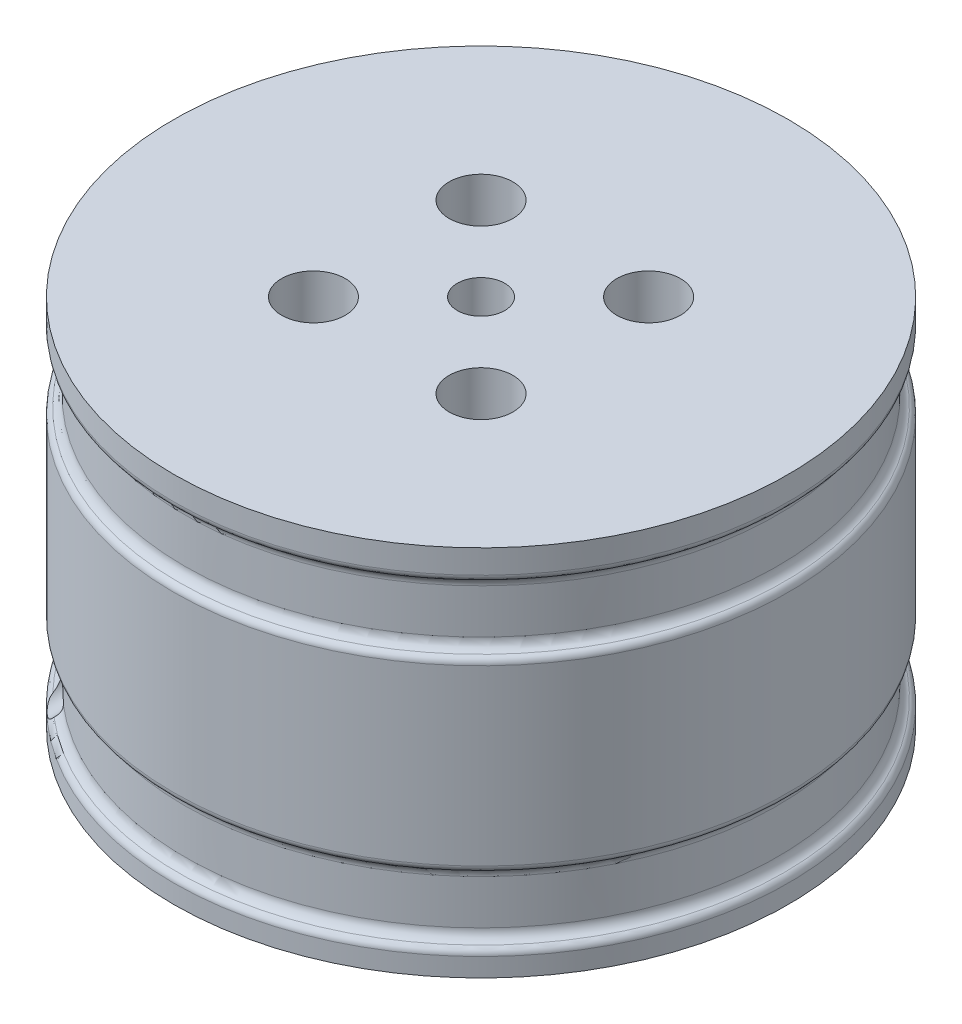
from build123d import *

# Parameters (mm, degrees)
SKETCH1_R               = 20
SKETCH1_R_2             = 1.6
SKETCH1_R_3             = 1.2
BOSS_EXTRUDE1_DEPTH     = 18.15
BOSS_EXTRUDE2_START     = -7
SKETCH1_3_R             = 20
SKETCH1_3_R_2           = 10
SKETCH1_3_R_3           = 4.2
SKETCH1_3_R_4           = 1.2
SKETCH1_3_R_5           = 1.6
BOSS_EXTRUDE2_DEPTH     = 7
CUT_EXTRUDE2_START      = -7
SKETCH1_4_R             = 10
SKETCH1_4_R_2           = 4.2
SKETCH1_4_R_3           = 1.2
SKETCH1_4_R_4           = 1.6
CUT_EXTRUDE2_DEPTH      = 1
CUT_EXTRUDE3_START      = -7
SKETCH1_5_R             = 4.2
SKETCH1_5_R_2           = 1.6
CUT_EXTRUDE3_DEPTH      = 7
CUT_EXTRUDE4_START      = 18.15
SKETCH8_R               = 2.15
CUT_EXTRUDE4_DEPTH      = 10.15
FILLET1_R               = 0.5
CUT_EXTRUDE1_DEPTH      = 35.504311498
CUT_EXTRUDE1_DEPTH_BACK = 35.504311498
SKETCH3_R               = 1
CUT_EXTRUDE5_START      = -9
SKETCH3_4_R             = 2
SKETCH3_4_R_2           = 1
CUT_EXTRUDE5_DEPTH      = 10


with BuildPart() as part:
    # Sketch1 → Boss-Extrude1 (new body)
    with BuildSketch(Plane(origin=(0, 0, 0), x_dir=(1, 0, 0), z_dir=(0, 1, 0))):
        with Locations(Location((0, 0, 0), (0, 0, 270))):
            Circle(SKETCH1_R)
        with Locations(Location((0, 0, 0), (0, 0, 270))):
            Circle(SKETCH1_R_2, mode=Mode.SUBTRACT)
        with Locations(Location((5.656854249, 5.656854249, 0), (0, 0, 270))):
            Circle(SKETCH1_R_3, mode=Mode.SUBTRACT)
        with Locations(Location((5.656854249, -5.656854249, 0), (0, 0, 270))):
            Circle(SKETCH1_R_3, mode=Mode.SUBTRACT)
        with Locations(Location((-5.656854249, -5.656854249, 0), (0, 0, 270))):
            Circle(SKETCH1_R_3, mode=Mode.SUBTRACT)
        with Locations(Location((-5.656854249, 5.656854249, 0), (0, 0, 270))):
            Circle(SKETCH1_R_3, mode=Mode.SUBTRACT)
    extrude(amount=BOSS_EXTRUDE1_DEPTH)

    # Sketch1<3> → Boss-Extrude2 (add)
    # profile 1 of 3: a face of its own
    with BuildSketch(Plane(origin=(0, 0, 0), x_dir=(1, 0, 0), z_dir=(0, 1, 0)).offset(BOSS_EXTRUDE2_START)):
        with Locations(Location((0, 0, 0), (0, 0, 270))):
            Circle(SKETCH1_3_R)
        Circle(SKETCH1_3_R_2, mode=Mode.SUBTRACT)
    # profile 2 of 3: a face of its own
    with BuildSketch(Plane(origin=(0, 0, 0), x_dir=(1, 0, 0), z_dir=(0, 1, 0)).offset(BOSS_EXTRUDE2_START)):
        Circle(SKETCH1_3_R_2)
        Circle(SKETCH1_3_R_3, mode=Mode.SUBTRACT)
        with Locations(Location((-5.656854249, 5.656854249, 0), (0, 0, 270))):
            Circle(SKETCH1_3_R_4, mode=Mode.SUBTRACT)
        with Locations(Location((-5.656854249, -5.656854249, 0), (0, 0, 270))):
            Circle(SKETCH1_3_R_4, mode=Mode.SUBTRACT)
        with Locations(Location((5.656854249, -5.656854249, 0), (0, 0, 270))):
            Circle(SKETCH1_3_R_4, mode=Mode.SUBTRACT)
        with Locations(Location((5.656854249, 5.656854249, 0), (0, 0, 270))):
            Circle(SKETCH1_3_R_4, mode=Mode.SUBTRACT)
    # profile 3 of 3: a face of its own
    with BuildSketch(Plane(origin=(0, 0, 0), x_dir=(1, 0, 0), z_dir=(0, 1, 0)).offset(BOSS_EXTRUDE2_START)):
        Circle(SKETCH1_3_R_3)
        with Locations(Location((0, 0, 0), (0, 0, 270))):
            Circle(SKETCH1_3_R_5, mode=Mode.SUBTRACT)
    extrude(amount=BOSS_EXTRUDE2_DEPTH)

    # Sketch1<4> → Cut-Extrude2 (cut)
    # profile 1 of 2: a face of its own
    with BuildSketch(Plane(origin=(0, 0, 0), x_dir=(1, 0, 0), z_dir=(0, 1, 0)).offset(CUT_EXTRUDE2_START)):
        with Locations(Location((0, 0, 0), (0, 0, 270))):
            Circle(SKETCH1_4_R)
        Circle(SKETCH1_4_R_2, mode=Mode.SUBTRACT)
        with Locations(Location((-5.656854249, 5.656854249, 0), (0, 0, 270))):
            Circle(SKETCH1_4_R_3, mode=Mode.SUBTRACT)
        with Locations(Location((-5.656854249, -5.656854249, 0), (0, 0, 270))):
            Circle(SKETCH1_4_R_3, mode=Mode.SUBTRACT)
        with Locations(Location((5.656854249, -5.656854249, 0), (0, 0, 270))):
            Circle(SKETCH1_4_R_3, mode=Mode.SUBTRACT)
        with Locations(Location((5.656854249, 5.656854249, 0), (0, 0, 270))):
            Circle(SKETCH1_4_R_3, mode=Mode.SUBTRACT)
    # profile 2 of 2: a face of its own
    with BuildSketch(Plane(origin=(0, 0, 0), x_dir=(1, 0, 0), z_dir=(0, 1, 0)).offset(CUT_EXTRUDE2_START)):
        Circle(SKETCH1_4_R_2)
        with Locations(Location((0, 0, 0), (0, 0, 270))):
            Circle(SKETCH1_4_R_4, mode=Mode.SUBTRACT)
    extrude(amount=CUT_EXTRUDE2_DEPTH, mode=Mode.SUBTRACT)

    # Sketch1<5> → Cut-Extrude3 (cut)
    with BuildSketch(Plane(origin=(0, 0, 0), x_dir=(1, 0, 0), z_dir=(0, 1, 0)).offset(CUT_EXTRUDE3_START)):
        with Locations(Location((0, 0, 0), (0, 0, 270))):
            Circle(SKETCH1_5_R)
        with Locations(Location((0, 0, 0), (0, 0, 270))):
            Circle(SKETCH1_5_R_2, mode=Mode.SUBTRACT)
    extrude(amount=CUT_EXTRUDE3_DEPTH, mode=Mode.SUBTRACT)

    # Sketch8 → Cut-Extrude4 (cut)
    with BuildSketch(Plane(origin=(0, 0, 0), x_dir=(1, 0, 0), z_dir=(0, 1, 0)).offset(CUT_EXTRUDE4_START)):
        with Locations(Location((5.656854249, 5.656854249, 0), (0, 0, 270))):
            Circle(SKETCH8_R)
        with Locations(Location((5.656854249, -5.656854249, 0), (0, 0, 270))):
            Circle(SKETCH8_R)
        with Locations(Location((-5.656854249, -5.656854249, 0), (0, 0, 270))):
            Circle(SKETCH8_R)
        with Locations(Location((-5.656854249, 5.656854249, 0), (0, 0, 270))):
            Circle(SKETCH8_R)
    extrude(amount=-CUT_EXTRUDE4_DEPTH, mode=Mode.SUBTRACT)

    # Sketch2 → Revolve1 (revolve)
    with BuildSketch(Plane.XY, mode=Mode.PRIVATE) as revolve1_sk:
        with BuildLine():
            ThreePointArc((20.75, -5.35), (20.219669914, -5.130330086), (20, -4.6))
            Line((20, -4.6), (20, -7))
            Line((20, -7), (20.75, -7))
            Line((20.75, -7), (20.75, -5.35))
        make_face()
        with BuildLine():
            Line((20, 18.15), (20, 15.4))
            ThreePointArc((20, 15.4), (20.219669914, 15.930330086), (20.75, 16.15))
            Line((20.75, 16.15), (20.75, 18.15))
            Line((20.75, 18.15), (20, 18.15))
        make_face()
        with BuildLine():
            Line((20.75, -0.85), (20.75, 11.65))
            ThreePointArc((20.75, 11.65), (20.219669914, 11.869669914), (20, 12.4))
            Line((20, 12.4), (20, -1.6))
            ThreePointArc((20, -1.6), (20.219669914, -1.069669914), (20.75, -0.85))
        make_face()
    revolve(revolve1_sk.sketch.rotate(Axis((0, 0, 0), (0, -1, 0)), 90), axis=Axis((0, 0, 0), (0, -1, 0)))

    # Fillet1
    fillet1_edges = [part.edges().sort_by_distance(p)[0] for p in [
        (0, -0.85, -20.75),
        (0, 11.65, -20.75),
        (0, -5.35, -20.75),
        (0, 16.15, -20.75),
    ]]
    fillet(fillet1_edges, radius=FILLET1_R)

    # Sketch3 → Cut-Extrude1 (cut, two sides: drawn at the far end of the back side and taken through both)
    with BuildSketch(Plane.XY.offset(-CUT_EXTRUDE1_DEPTH_BACK)):
        with Locations((-14, -4.6)):
            Circle(SKETCH3_R)
        with Locations((-14, 15.4)):
            Circle(SKETCH3_R)
    extrude(amount=CUT_EXTRUDE1_DEPTH + CUT_EXTRUDE1_DEPTH_BACK, mode=Mode.SUBTRACT)

    # Sketch3<4> → Cut-Extrude5 (cut)
    # profile 1 of 2: a face of its own
    with BuildSketch(Plane.XY.offset(CUT_EXTRUDE5_START)):
        with Locations((-14, -4.6)):
            Circle(SKETCH3_4_R)
        with Locations((-14, -4.6)):
            Circle(SKETCH3_4_R_2, mode=Mode.SUBTRACT)
    # profile 2 of 2: a face of its own
    with BuildSketch(Plane.XY.offset(CUT_EXTRUDE5_START)):
        with Locations((-14, 15.4)):
            Circle(SKETCH3_4_R)
        with Locations((-14, 15.4)):
            Circle(SKETCH3_4_R_2, mode=Mode.SUBTRACT)
    extrude(amount=-CUT_EXTRUDE5_DEPTH, mode=Mode.SUBTRACT)


solid = part.part
